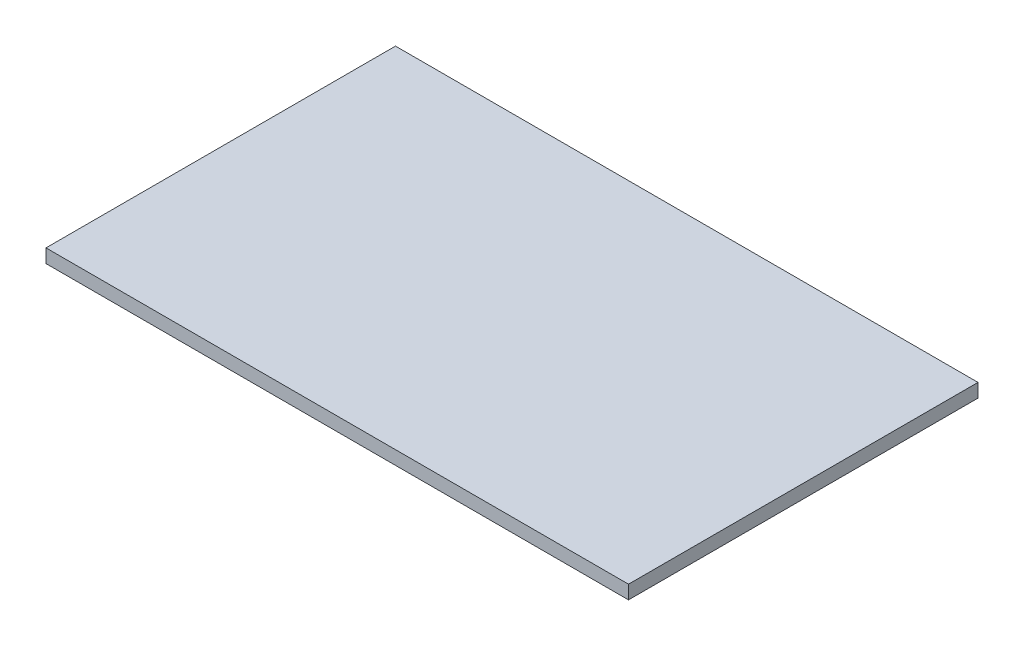
from build123d import *

# Parameters (mm, degrees)
SKETCH1_W           = 127
SKETCH1_H           = 76.2
BOSS_EXTRUDE1_DEPTH = 2.9718


with BuildPart() as part:
    # Sketch1 → Boss-Extrude1 (new body)
    with BuildSketch(Plane(origin=(0, 0, 0), x_dir=(1, 0, 0), z_dir=(0, 1, 0))):
        with Locations((63.5, 38.1)):
            Rectangle(SKETCH1_W, SKETCH1_H)
    extrude(amount=BOSS_EXTRUDE1_DEPTH)


solid = part.part
